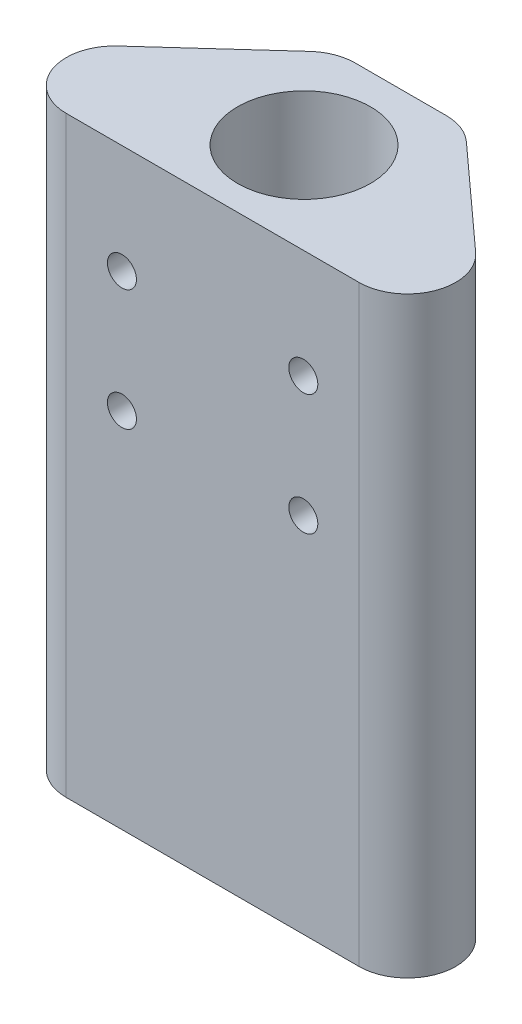
from build123d import *

# Parameters (mm, degrees)
SKETCH1_R           = 3.25
BOSS_EXTRUDE1_DEPTH = 49
FILLET1_R           = 4
SKETCH2_R           = 5.5
CUT_EXTRUDE1_DEPTH  = 33
SKETCH3_R           = 1.2
CUT_EXTRUDE2_DEPTH  = 54.875656369


with BuildPart() as part:
    # Sketch1 → Boss-Extrude1 (new body)
    with BuildSketch(Plane(origin=(0, 0, 0), x_dir=(1, 0, 0), z_dir=(0, 1, 0))):
        Polygon((-5.320759509, 8), (-22.469015665, -7.56), (22.469015665, -7.56), (5.320759509, 8), align=None)
        with Locations(Location((0, 0, 0), (0, 0, 270))):
            Circle(SKETCH1_R, mode=Mode.SUBTRACT)
    extrude(amount=BOSS_EXTRUDE1_DEPTH)

    # Fillet1
    fillet1_edges = [part.edges().sort_by_distance(p)[0] for p in [
        (5.320759509, 24.5, -8),
        (22.469015665, 24.5, 7.56),
        (-22.469015665, 24.5, 7.56),
        (-5.320759509, 24.5, -8),
    ]]
    fillet(fillet1_edges, radius=FILLET1_R)

    # Sketch2 → Cut-Extrude1 (cut)
    with BuildSketch(Plane(origin=(0, 49, 0), x_dir=(1, 0, 0), z_dir=(0, 1, 0))):
        with Locations(Location((0, 0, 0), (0, 0, 270))):
            Circle(SKETCH2_R)
    extrude(amount=-CUT_EXTRUDE1_DEPTH, mode=Mode.SUBTRACT)

    # Sketch3 → Cut-Extrude2 (cut, through all)
    with BuildSketch(Plane.XY.offset(7.56)):
        with Locations((-7.5, 40)):
            Circle(SKETCH3_R)
        with Locations((7.5, 40)):
            Circle(SKETCH3_R)
        with Locations((7.5, 30)):
            Circle(SKETCH3_R)
        with Locations((-7.5, 30)):
            Circle(SKETCH3_R)
    extrude(amount=-CUT_EXTRUDE2_DEPTH, mode=Mode.SUBTRACT)


solid = part.part
